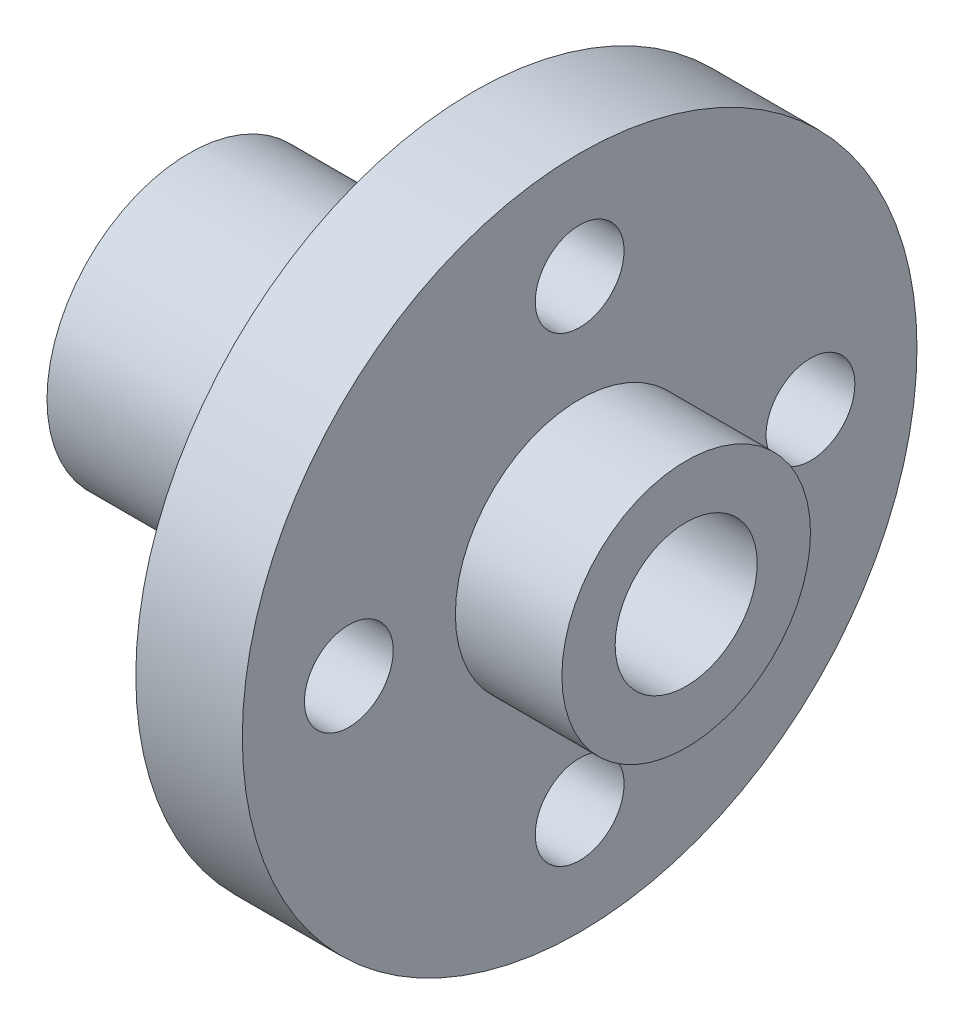
from build123d import *

# Parameters (mm, degrees)
SKETCH1_R           = 9.5
SKETCH1_R_2         = 1.25
SKETCH1_R_3         = 4
SKETCH1_R_4         = 3.5
BOSS_EXTRUDE1_DEPTH = 3
SKETCH1_3_R         = 3.5
SKETCH1_3_R_2       = 2
BOSS_EXTRUDE2_DEPTH = 6
BOSS_EXTRUDE3_START = -8
SKETCH1_4_R         = 4
SKETCH1_4_R_2       = 3.5
SKETCH1_4_R_3       = 2
BOSS_EXTRUDE3_DEPTH = 8


with BuildPart() as part:
    # Sketch1 → Boss-Extrude1 (new body)
    # profile 1 of 2: a face of its own
    with BuildSketch(Plane(origin=(0, 0, 0), x_dir=(0, 0, -1), z_dir=(1, 0, 0))):
        Circle(SKETCH1_R)
        with Locations((-6.5, 0)):
            Circle(SKETCH1_R_2, mode=Mode.SUBTRACT)
        with Locations((0, -6.5)):
            Circle(SKETCH1_R_2, mode=Mode.SUBTRACT)
        with Locations((6.5, 0)):
            Circle(SKETCH1_R_2, mode=Mode.SUBTRACT)
        with Locations((0, 6.5)):
            Circle(SKETCH1_R_2, mode=Mode.SUBTRACT)
        Circle(SKETCH1_R_3, mode=Mode.SUBTRACT)
    # profile 2 of 2: a face of its own
    with BuildSketch(Plane(origin=(0, 0, 0), x_dir=(0, 0, -1), z_dir=(1, 0, 0))):
        Circle(SKETCH1_R_3)
        Circle(SKETCH1_R_4, mode=Mode.SUBTRACT)
    extrude(amount=BOSS_EXTRUDE1_DEPTH)

    # Sketch1<3> → Boss-Extrude2 (add)
    with BuildSketch(Plane(origin=(0, 0, 0), x_dir=(0, 0, -1), z_dir=(1, 0, 0))):
        Circle(SKETCH1_3_R)
        Circle(SKETCH1_3_R_2, mode=Mode.SUBTRACT)
    extrude(amount=BOSS_EXTRUDE2_DEPTH)

    # Sketch1<4> → Boss-Extrude3 (add)
    # profile 1 of 2: a face of its own
    with BuildSketch(Plane(origin=(0, 0, 0), x_dir=(0, 0, -1), z_dir=(1, 0, 0)).offset(BOSS_EXTRUDE3_START)):
        Circle(SKETCH1_4_R)
        Circle(SKETCH1_4_R_2, mode=Mode.SUBTRACT)
    # profile 2 of 2: a face of its own
    with BuildSketch(Plane(origin=(0, 0, 0), x_dir=(0, 0, -1), z_dir=(1, 0, 0)).offset(BOSS_EXTRUDE3_START)):
        Circle(SKETCH1_4_R_2)
        Circle(SKETCH1_4_R_3, mode=Mode.SUBTRACT)
    extrude(amount=BOSS_EXTRUDE3_DEPTH)

    # Cut-Extrude1 cone 1 section (through the dimple's axis) → Cut-Extrude1 (revolve, cut)
    with BuildSketch(Plane(origin=(-8, 0, 0), x_dir=(0, 0, 1), z_dir=(0, 1, 0))):
        Polygon((0, 0), (3.5, 0), (0, 3.5), align=None)
    revolve(axis=Axis((-8, 0, 0), (1, 0, 0)), mode=Mode.SUBTRACT)


solid = part.part
